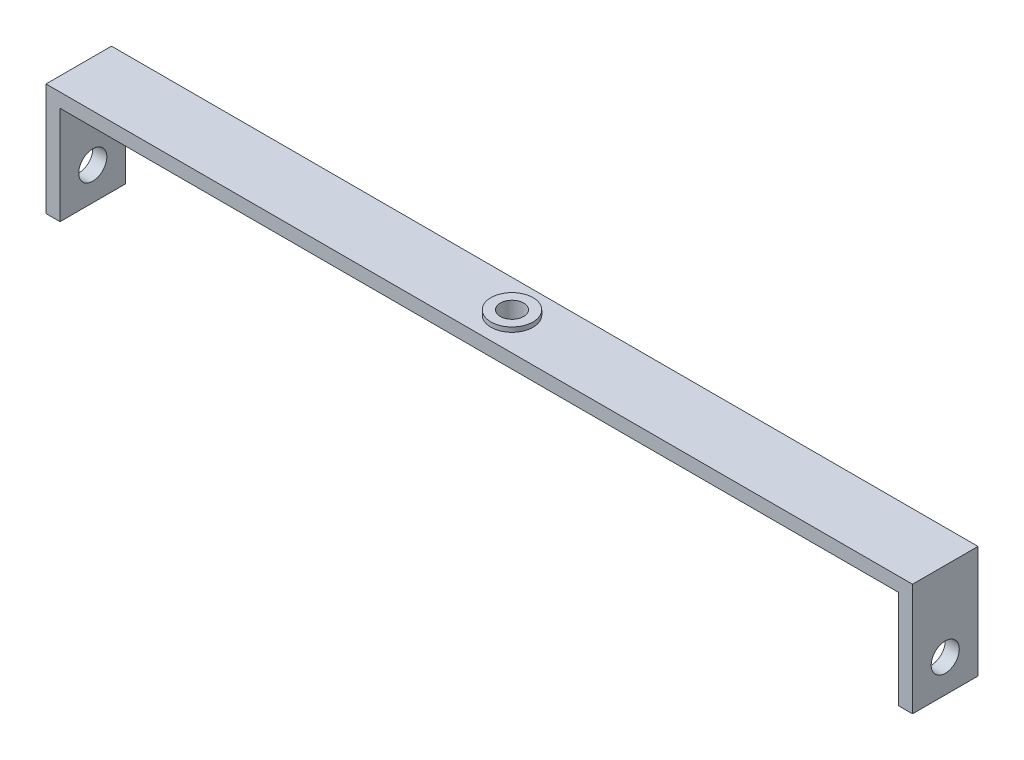
from build123d import *

# Parameters (mm, degrees)
BOSS_EXTRUDE1_DEPTH            = 3.5
BOSS_EXTRUDE1_DEPTH_BACK       = 3.5
SKETCH2_R                      = 1.25
CUT_EXTRUDE1_DEPTH             = 3.5
BOSS_EXTRUDE2_START            = 0.5
SKETCH3_R                      = 2.25
SKETCH3_R_2                    = 1.25
BOSS_EXTRUDE2_DEPTH            = 0.5
CUT_EXTRUDE2_REACH             = 49.958
SKETCH4_R                      = 1.5
CUT_EXTRUDE2_DIRECTION_2_REACH = 49.958


with BuildPart() as part:
    # Sketch1 → Boss-Extrude1 (new, two sides: drawn at the far end of the back side and taken through both)
    with BuildSketch(Plane.XY.offset(-BOSS_EXTRUDE1_DEPTH_BACK)):
        Polygon((-46.3, 0), (46.3, 0), (46.3, -12), (44.8, -12), (44.8, -1.5), (-44.8, -1.5), (-44.8, -12), (-46.3, -12), align=None)
    extrude(amount=BOSS_EXTRUDE1_DEPTH + BOSS_EXTRUDE1_DEPTH_BACK)

    # Sketch2 → Cut-Extrude1 (cut)
    with BuildSketch(Plane(origin=(0, 0, 0), x_dir=(1, 0, 0), z_dir=(0, 1, 0))):
        Circle(SKETCH2_R)
    extrude(amount=-CUT_EXTRUDE1_DEPTH, mode=Mode.SUBTRACT)

    # Sketch3 → Boss-Extrude2 (add)
    with BuildSketch(Plane(origin=(0, 0, 0), x_dir=(1, 0, 0), z_dir=(0, 1, 0)).offset(BOSS_EXTRUDE2_START)):
        Circle(SKETCH3_R)
        Circle(SKETCH3_R_2, mode=Mode.SUBTRACT)
    extrude(amount=-BOSS_EXTRUDE2_DEPTH)

    # Cut-Extrude2: up to this face of the body (flat: up to its plane)
    cut_extrude2_end = Plane(part.part.faces().sort_by_distance((-46.3, -6, 0))[0])
    # Sketch4 → Cut-Extrude2 (cut, up to the picked face)
    with BuildSketch(Plane(origin=(0, 0, 0), x_dir=(0, 0, -1), z_dir=(1, 0, 0)), mode=Mode.PRIVATE) as cut_extrude2_sk1:
        with Locations((0, -8.5)):
            Circle(SKETCH4_R)
    cut_extrude2_tool1 = split(extrude(cut_extrude2_sk1.sketch, amount=-CUT_EXTRUDE2_REACH, mode=Mode.PRIVATE), bisect_by=cut_extrude2_end, keep=Keep.BOTH, mode=Mode.PRIVATE)
    add(cut_extrude2_tool1.solids().sort_by(Axis((0, -8.5, 0), (-1, 0, 0)))[0], mode=Mode.SUBTRACT)

    # Cut-Extrude2 direction 2: up to this face of the body (flat: up to its plane)
    cut_extrude2_direction_2_end = Plane(part.part.faces().sort_by_distance((46.3, -6, 0))[0])
    # Sketch4 → Cut-Extrude2 direction 2 (cut, up to the picked face)
    with BuildSketch(Plane(origin=(0, 0, 0), x_dir=(0, 0, -1), z_dir=(1, 0, 0)), mode=Mode.PRIVATE) as cut_extrude2_direction_2_sk1:
        with Locations((0, -8.5)):
            Circle(SKETCH4_R)
    cut_extrude2_direction_2_tool1 = split(extrude(cut_extrude2_direction_2_sk1.sketch, amount=CUT_EXTRUDE2_DIRECTION_2_REACH, mode=Mode.PRIVATE), bisect_by=cut_extrude2_direction_2_end, keep=Keep.BOTH, mode=Mode.PRIVATE)
    add(cut_extrude2_direction_2_tool1.solids().sort_by(Axis((0, -8.5, 0), (1, 0, 0)))[0], mode=Mode.SUBTRACT)


solid = part.part
